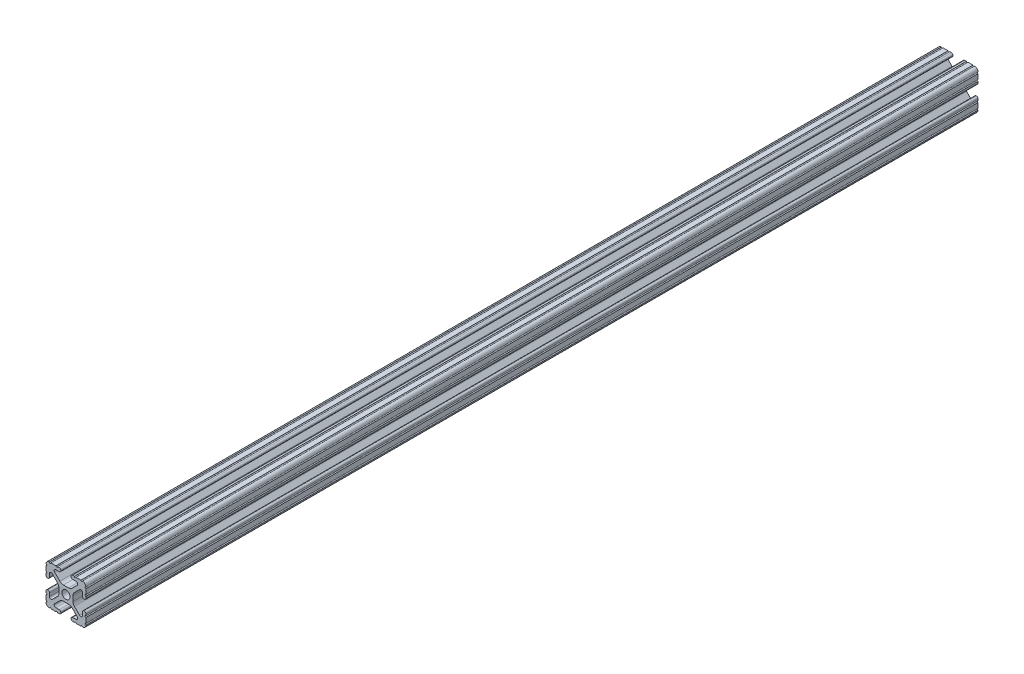
from build123d import *

# Parameters (mm, degrees)
SKETCH1_R           = 2.6035
BOSS_EXTRUDE1_DEPTH = 284.1625


with BuildPart() as part:
    # Sketch1 → Boss-Extrude1 (new, symmetric)
    with BuildSketch(Plane.XY):
        with BuildLine():
            Line((-7.179650497, -8.645192506), (-3.952270251, -5.423690499))
            ThreePointArc((-3.952270251, -5.423690499), (-2.922936451, -4.736929036), (-1.709253557, -4.4958))
            Line((-1.709253557, -4.4958), (1.709253557, -4.4958))
            ThreePointArc((1.709253557, -4.4958), (2.922936451, -4.736929036), (3.952270251, -5.423690499))
            Line((3.952270251, -5.423690499), (7.179650497, -8.645192506))
            ThreePointArc((7.179650497, -8.645192506), (7.41473083, -9.822813117), (6.416408329, -10.4902))
            Line((6.416408329, -10.4902), (4.287512407, -10.4902))
            ThreePointArc((4.287512407, -10.4902), (3.54574862, -10.79744862), (3.2385, -11.539212407))
            Line((3.2385, -11.539212407), (3.2385, -11.650987593))
            ThreePointArc((3.2385, -11.650987593), (3.54574862, -12.39275138), (4.287512407, -12.7))
            Line((4.287512407, -12.7), (5.317126718, -12.7))
            ThreePointArc((5.317126718, -12.7), (5.825126718, -12.192), (6.333126718, -12.7))
            Line((6.333126718, -12.7), (9.550443118, -12.7))
            ThreePointArc((9.550443118, -12.7), (10.058366869, -12.192000006), (10.566443095, -12.699847501))
            ThreePointArc((10.566443095, -12.699847501), (12.082537762, -12.08250727), (12.699846982, -10.566399977))
            ThreePointArc((12.699846982, -10.566399977), (12.192000006, -10.058323491), (12.7, -9.5504))
            Line((12.7, -9.5504), (12.7, -6.3330836))
            ThreePointArc((12.7, -6.3330836), (12.192, -5.8250836), (12.7, -5.3170836))
            Line((12.7, -5.3170836), (12.7, -4.287469289))
            ThreePointArc((12.7, -4.287469289), (12.39275138, -3.545705502), (11.650987593, -3.238456882))
            Line((11.650987593, -3.238456882), (11.539212407, -3.238456882))
            ThreePointArc((11.539212407, -3.238456882), (10.79744862, -3.545705502), (10.4902, -4.287469289))
            Line((10.4902, -4.287469289), (10.4902, -6.402089023))
            ThreePointArc((10.4902, -6.402089023), (9.856505071, -7.351067942), (8.737131347, -7.129408934))
            Line((8.737131347, -7.129408934), (5.441005833, -3.840816462))
            ThreePointArc((5.441005833, -3.840816462), (4.750877967, -2.809883091), (4.5085, -1.593185507))
            Line((4.5085, -1.593185507), (4.5085, 1.593185507))
            ThreePointArc((4.5085, 1.593185507), (4.750877967, 2.809883091), (5.441005833, 3.840816462))
            Line((5.441005833, 3.840816462), (8.737131347, 7.129408934))
            ThreePointArc((8.737131347, 7.129408934), (9.856505071, 7.351067942), (10.4902, 6.402089023))
            Line((10.4902, 6.402089023), (10.4902, 4.287469289))
            ThreePointArc((10.4902, 4.287469289), (10.79744862, 3.545705502), (11.539212407, 3.238456882))
            Line((11.539212407, 3.238456882), (11.650987593, 3.238456882))
            ThreePointArc((11.650987593, 3.238456882), (12.39275138, 3.545705502), (12.7, 4.287469289))
            Line((12.7, 4.287469289), (12.7, 5.3170836))
            ThreePointArc((12.7, 5.3170836), (12.192, 5.8250836), (12.7, 6.3330836))
            Line((12.7, 6.3330836), (12.7, 9.5504))
            ThreePointArc((12.7, 9.5504), (12.192000006, 10.058323491), (12.699846982, 10.566399977))
            ThreePointArc((12.699846982, 10.566399977), (12.082537762, 12.08250727), (10.566443095, 12.699847501))
            ThreePointArc((10.566443095, 12.699847501), (10.058366869, 12.192000006), (9.550443118, 12.7))
            Line((9.550443118, 12.7), (6.333126718, 12.7))
            ThreePointArc((6.333126718, 12.7), (5.825126718, 12.192), (5.317126718, 12.7))
            Line((5.317126718, 12.7), (4.287512407, 12.7))
            ThreePointArc((4.287512407, 12.7), (3.54574862, 12.39275138), (3.2385, 11.650987593))
            Line((3.2385, 11.650987593), (3.2385, 11.539212407))
            ThreePointArc((3.2385, 11.539212407), (3.54574862, 10.79744862), (4.287512407, 10.4902))
            Line((4.287512407, 10.4902), (6.476788598, 10.4902))
            ThreePointArc((6.476788598, 10.4902), (7.432222385, 9.85140422), (7.207036008, 8.724370562))
            Line((7.207036008, 8.724370562), (3.898272566, 5.423169045))
            ThreePointArc((3.898272566, 5.423169045), (2.869120213, 4.736787962), (1.655778399, 4.4958))
            Line((1.655778399, 4.4958), (-1.655778399, 4.4958))
            ThreePointArc((-1.655778399, 4.4958), (-2.869120213, 4.736787962), (-3.898272566, 5.423169045))
            Line((-3.898272566, 5.423169045), (-7.207036008, 8.724370562))
            ThreePointArc((-7.207036008, 8.724370562), (-7.432222385, 9.85140422), (-6.476788598, 10.4902))
            Line((-6.476788598, 10.4902), (-4.287512407, 10.4902))
            ThreePointArc((-4.287512407, 10.4902), (-3.54574862, 10.79744862), (-3.2385, 11.539212407))
            Line((-3.2385, 11.539212407), (-3.2385, 11.650987593))
            ThreePointArc((-3.2385, 11.650987593), (-3.54574862, 12.39275138), (-4.287512407, 12.7))
            Line((-4.287512407, 12.7), (-5.317126718, 12.7))
            ThreePointArc((-5.317126718, 12.7), (-5.825126718, 12.192), (-6.333126718, 12.7))
            Line((-6.333126718, 12.7), (-9.550443118, 12.7))
            ThreePointArc((-9.550443118, 12.7), (-10.058366869, 12.192000006), (-10.566443095, 12.699847501))
            ThreePointArc((-10.566443095, 12.699847501), (-12.082537762, 12.08250727), (-12.699846982, 10.566399977))
            ThreePointArc((-12.699846982, 10.566399977), (-12.192000006, 10.058323491), (-12.7, 9.5504))
            Line((-12.7, 9.5504), (-12.7, 6.3330836))
            ThreePointArc((-12.7, 6.3330836), (-12.192, 5.8250836), (-12.7, 5.3170836))
            Line((-12.7, 5.3170836), (-12.7, 4.287469289))
            ThreePointArc((-12.7, 4.287469289), (-12.39275138, 3.545705502), (-11.650987593, 3.238456882))
            Line((-11.650987593, 3.238456882), (-11.539212407, 3.238456882))
            ThreePointArc((-11.539212407, 3.238456882), (-10.79744862, 3.545705502), (-10.4902, 4.287469289))
            Line((-10.4902, 4.287469289), (-10.4902, 6.402089023))
            ThreePointArc((-10.4902, 6.402089023), (-9.856505071, 7.351067942), (-8.737131347, 7.129408934))
            Line((-8.737131347, 7.129408934), (-5.441005833, 3.840816462))
            ThreePointArc((-5.441005833, 3.840816462), (-4.750877967, 2.809883091), (-4.5085, 1.593185507))
            Line((-4.5085, 1.593185507), (-4.5085, -1.593185507))
            ThreePointArc((-4.5085, -1.593185507), (-4.750877967, -2.809883091), (-5.441005833, -3.840816462))
            Line((-5.441005833, -3.840816462), (-8.737131347, -7.129408934))
            ThreePointArc((-8.737131347, -7.129408934), (-9.856505071, -7.351067942), (-10.4902, -6.402089023))
            Line((-10.4902, -6.402089023), (-10.4902, -4.287469289))
            ThreePointArc((-10.4902, -4.287469289), (-10.79744862, -3.545705502), (-11.539212407, -3.238456882))
            Line((-11.539212407, -3.238456882), (-11.650987593, -3.238456882))
            ThreePointArc((-11.650987593, -3.238456882), (-12.39275138, -3.545705502), (-12.7, -4.287469289))
            Line((-12.7, -4.287469289), (-12.7, -5.3170836))
            ThreePointArc((-12.7, -5.3170836), (-12.192, -5.8250836), (-12.7, -6.3330836))
            Line((-12.7, -6.3330836), (-12.7, -9.5504))
            ThreePointArc((-12.7, -9.5504), (-12.192000006, -10.058323491), (-12.699846982, -10.566399977))
            ThreePointArc((-12.699846982, -10.566399977), (-12.082537762, -12.08250727), (-10.566443095, -12.699847501))
            ThreePointArc((-10.566443095, -12.699847501), (-10.058366869, -12.192000006), (-9.550443118, -12.7))
            Line((-9.550443118, -12.7), (-6.333126718, -12.7))
            ThreePointArc((-6.333126718, -12.7), (-5.825126718, -12.192), (-5.317126718, -12.7))
            Line((-5.317126718, -12.7), (-4.287512407, -12.7))
            ThreePointArc((-4.287512407, -12.7), (-3.54574862, -12.39275138), (-3.2385, -11.650987593))
            Line((-3.2385, -11.650987593), (-3.2385, -11.539212407))
            ThreePointArc((-3.2385, -11.539212407), (-3.54574862, -10.79744862), (-4.287512407, -10.4902))
            Line((-4.287512407, -10.4902), (-6.416408329, -10.4902))
            ThreePointArc((-6.416408329, -10.4902), (-7.41473083, -9.822813117), (-7.179650497, -8.645192506))
        make_face()
        with Locations(Location((0, 0, 0), (0, 0, 180))):
            Circle(SKETCH1_R, mode=Mode.SUBTRACT)
    extrude(amount=BOSS_EXTRUDE1_DEPTH, both=True)


solid = part.part
